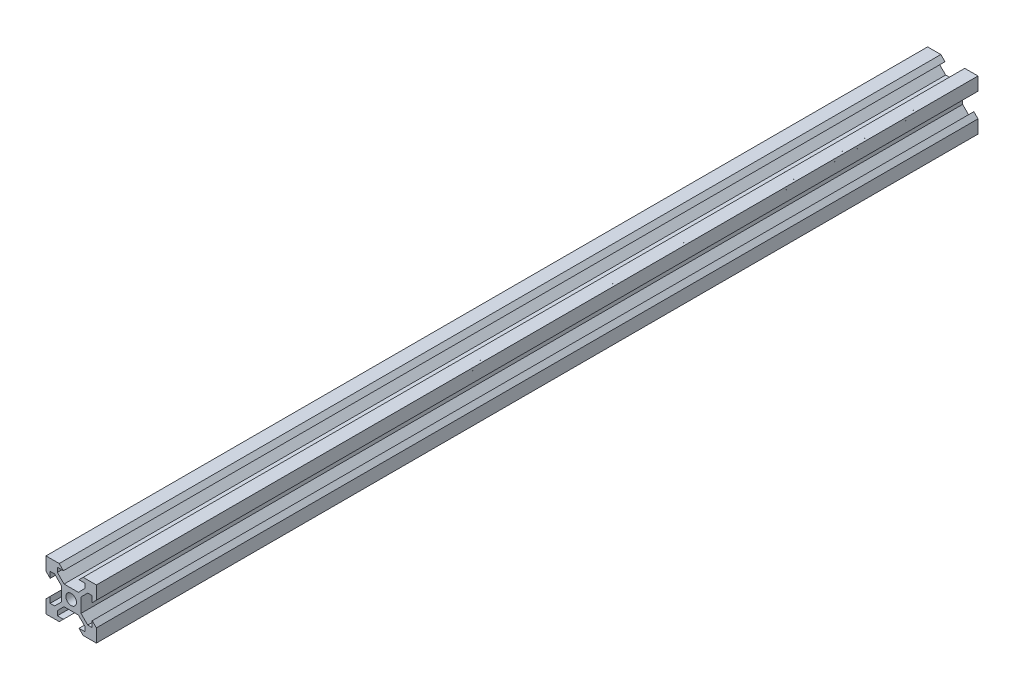
from build123d import *

# Parameters (mm, degrees)
SKETCH1_R           = 2.1
BOSS_EXTRUDE1_DEPTH = 350


with BuildPart() as part:
    # Sketch1 → Boss-Extrude1 (new body)
    with BuildSketch(Plane.XY):
        Polygon((2.834320347, 3.893970342), (5.5, 6.558849663), (5.5, 8.349069506), (3.1, 8.349069506), (4.75, 9.998574117), (10, 9.998574117), (10, 4.746997406), (8.35, 3.097492795), (8.350720674, 5.497492687), (6.560500912, 5.498030255), (3.894821259, 2.833150935), (3.894821259, -2.833150935), (6.560500912, -5.498030255), (8.350720674, -5.497492687), (8.35, -3.097492795), (10, -4.746997406), (10, -9.998574117), (4.75, -9.998574117), (3.1, -8.349069506), (5.5, -8.349069506), (5.5, -6.558849663), (2.834320347, -3.893970342), (-2.834320347, -3.893970342), (-5.5, -6.558849663), (-5.5, -8.349069506), (-3.1, -8.349069506), (-4.75, -9.998574117), (-10, -9.998574117), (-10, -4.746997406), (-8.35, -3.097492795), (-8.350720674, -5.497492687), (-6.560500912, -5.498030255), (-3.894821259, -2.833150935), (-3.894821259, 2.833150935), (-6.560500912, 5.498030255), (-8.350720674, 5.497492687), (-8.35, 3.097492795), (-10, 4.746997406), (-10, 9.998574117), (-4.75, 9.998574117), (-3.1, 8.349069506), (-5.5, 8.349069506), (-5.5, 6.558849663), (-2.834320347, 3.893970342), align=None)
        Circle(SKETCH1_R, mode=Mode.SUBTRACT)
    extrude(amount=BOSS_EXTRUDE1_DEPTH)


solid = part.part
